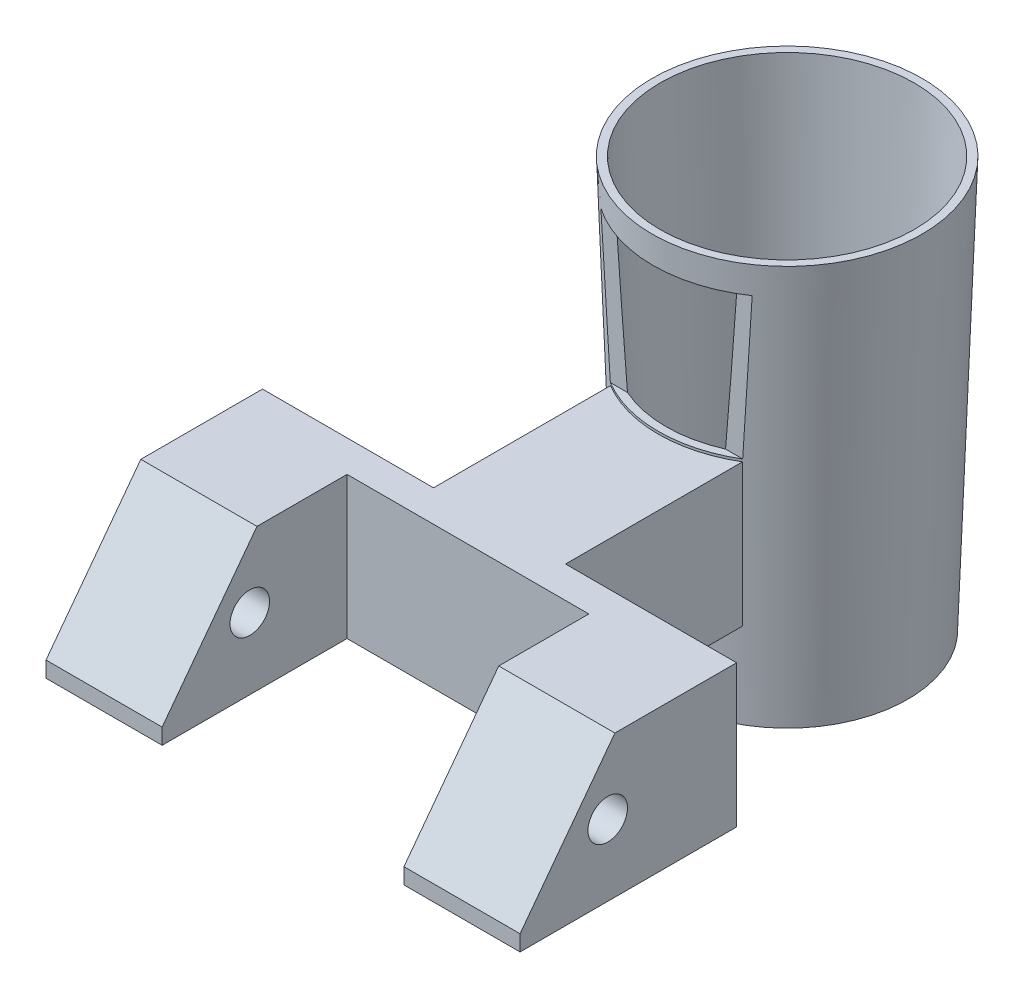
from build123d import *

# Parameters (mm, degrees)
SKETCH1_R           = 7.635
BOSS_EXTRUDE1_DEPTH = 26.95
BOSS_EXTRUDE1_DRAFT = -2
SKETCH5_W           = 30
SKETCH5_H           = 9
BOSS_EXTRUDE3_DEPTH = 24.9
SKETCH6_R           = 7.135
CUT_EXTRUDE1_DEPTH  = 37
CUT_EXTRUDE1_DRAFT  = 2
SKETCH7_W           = 15.3
SKETCH7_H           = 11.7
SKETCH7_W_2         = 10.82308768
SKETCH7_H_2         = 11.2
CUT_EXTRUDE2_DEPTH  = 38
CUT_EXTRUDE3_DEPTH  = 32
SKETCH9_R           = 1.25
CUT_EXTRUDE4_DEPTH  = 32
SKETCH10_W          = 17.5
SKETCH10_H          = 9.25
CUT_EXTRUDE5_DEPTH  = 15
SKETCH3_R           = 11.551989241
CUT_EXTRUDE6_DEPTH  = 1


with BuildPart() as part:
    # Sketch1 → Boss-Extrude1 (with draft: the straight prism first)
    with BuildSketch(Plane(origin=(0, 0, 0), x_dir=(1, 0, 0), z_dir=(0, 1, 0))):
        Circle(SKETCH1_R)
    extrude(amount=BOSS_EXTRUDE1_DEPTH)
    # Boss-Extrude1: the draft: its side faces are tilted about the plane it starts from
    boss_extrude1_sides = [part.faces().sort_by_distance(p)[0] for p in [
        (-7.635, 13.475, 0),
    ]]
    draft(boss_extrude1_sides, Plane(origin=(0, 0, 0), x_dir=(1, 0, 0), z_dir=(0, 1, 0)), BOSS_EXTRUDE1_DRAFT)

    # Sketch5 → Boss-Extrude3 (add)
    with BuildSketch(Plane.XY.offset(7)):
        with Locations((0, 10.29)):
            Rectangle(SKETCH5_W, SKETCH5_H)
    extrude(amount=BOSS_EXTRUDE3_DEPTH)


with BuildPart() as cut_extrude1_tool:
    # Sketch6 → Cut-Extrude1 (with draft: the straight prism first)
    with BuildSketch(Plane.XZ):
        Circle(SKETCH6_R)
    extrude(amount=-CUT_EXTRUDE1_DEPTH)
    # Cut-Extrude1: the draft: its side faces are tilted about the plane it starts from
    cut_extrude1_sides = [cut_extrude1_tool.faces().sort_by_distance(p)[0] for p in [
        (-7.135, 18.5, 0),
    ]]
    draft(cut_extrude1_sides, Plane.XZ, CUT_EXTRUDE1_DRAFT)


with BuildPart() as part_1:
    add(part.part)

    # Cut-Extrude1: cut by cut_extrude1_tool
    add(cut_extrude1_tool.part, mode=Mode.SUBTRACT)

    # Sketch7 → Cut-Extrude2 (cut)
    with BuildSketch(Plane(origin=(0, 14.79, 0), x_dir=(1, 0, 0), z_dir=(0, 1, 0))):
        with Locations((0, -26.05)):
            Rectangle(SKETCH7_W, SKETCH7_H)
        with Locations((9.58845616, -12.6)):
            Rectangle(SKETCH7_W_2, SKETCH7_H_2)
        with Locations((-9.58845616, -12.6)):
            Rectangle(SKETCH7_W_2, SKETCH7_H_2)
    extrude(amount=-CUT_EXTRUDE2_DEPTH, mode=Mode.SUBTRACT)

    # Sketch8 → Cut-Extrude3 (cut)
    with BuildSketch(Plane.ZY.offset(15)):
        Polygon((31.9, 6.79), (25.9, 14.79), (31.9, 14.79), align=None)
    extrude(amount=-CUT_EXTRUDE3_DEPTH, mode=Mode.SUBTRACT)

    # Sketch9 → Cut-Extrude4 (cut)
    with BuildSketch(Plane.ZY.offset(15)):
        with Locations(Location((26.353732334, 10.29, 0), (0, 0, 270))):
            Circle(SKETCH9_R)
    extrude(amount=-CUT_EXTRUDE4_DEPTH, mode=Mode.SUBTRACT)

    # Sketch10 → Cut-Extrude5 (cut)
    with BuildSketch(Plane.XY.offset(7)):
        with Locations((0, 19.575)):
            Rectangle(SKETCH10_W, SKETCH10_H)
    extrude(amount=CUT_EXTRUDE5_DEPTH, mode=Mode.SUBTRACT)

    # Sketch3 → Cut-Extrude6 (cut)
    with BuildSketch(Plane(origin=(0, 26.95, 0), x_dir=(1, 0, 0), z_dir=(0, 1, 0))):
        Circle(SKETCH3_R)
    extrude(amount=-CUT_EXTRUDE6_DEPTH, mode=Mode.SUBTRACT)


solid = part_1.part
